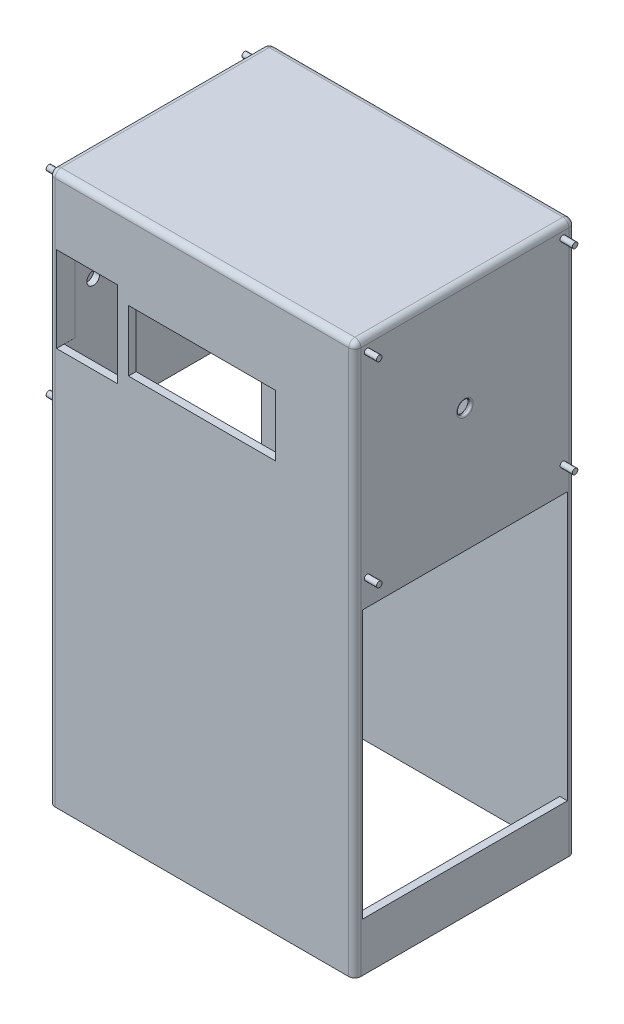
from build123d import *

# Parameters (mm, degrees)
SKETCH1_W           = 127
SKETCH1_H           = 91.44
BOSS_EXTRUDE1_DEPTH = 228.6
SKETCH3_W           = 120.65
SKETCH3_H           = 85.09
CUT_EXTRUDE1_DEPTH  = 226.06
SKETCH2_R           = 2.667
CUT_EXTRUDE2_DEPTH  = 266.475570251
SKETCH4_R           = 1.143
BOSS_EXTRUDE3_DEPTH = 5.08
SKETCH5_R           = 20.32
CUT_EXTRUDE3_DEPTH  = 1.27
FILLET1_R           = 0.762
FILLET2_R           = 0.762
FILLET3_R           = 0.762
SKETCH6_W           = 60.96
SKETCH6_H           = 25.4
CUT_EXTRUDE4_DEPTH  = 256.582569828
FILLET4_R           = 2.54
SKETCH7_W           = 85.09
SKETCH7_H           = 111.152565629
CUT_EXTRUDE5_DEPTH  = 268.942913323
SKETCH10_R          = 2.667
CUT_EXTRUDE6_DEPTH  = 2.54
CUT_EXTRUDE7_DEPTH  = 7.62
SKETCH13_R          = 2.667
CUT_EXTRUDE8_DEPTH  = 2.54
CUT_EXTRUDE9_DEPTH  = 7.62


with BuildPart() as part:
    # Sketch1 → Boss-Extrude1 (new body)
    with BuildSketch(Plane(origin=(0, 0, 0), x_dir=(1, 0, 0), z_dir=(0, 1, 0))):
        Rectangle(SKETCH1_W, SKETCH1_H)
    extrude(amount=BOSS_EXTRUDE1_DEPTH)

    # Sketch3 → Cut-Extrude1 (cut)
    with BuildSketch(Plane.XZ):
        Rectangle(SKETCH3_W, SKETCH3_H)
    extrude(amount=-CUT_EXTRUDE1_DEPTH, mode=Mode.SUBTRACT)

    # Sketch2 → Cut-Extrude2 (cut, through all)
    with BuildSketch(Plane(origin=(63.5, 0, 0), x_dir=(0, 0, -1), z_dir=(1, 0, 0))):
        with Locations((0, 182.88)):
            Circle(SKETCH2_R)
    extrude(amount=-CUT_EXTRUDE2_DEPTH, mode=Mode.SUBTRACT)

    # Sketch4 → Boss-Extrude3 (add)
    with BuildSketch(Plane(origin=(63.5, 0, 0), x_dir=(0, 0, -1), z_dir=(1, 0, 0))):
        with Locations(Location((-40.64, 223.52, 0), (0, 0, 180))):
            Circle(SKETCH4_R)
        with Locations(Location((40.64, 223.52, 0), (0, 0, 180))):
            Circle(SKETCH4_R)
        with Locations(Location((40.64, 142.24, 0), (0, 0, 180))):
            Circle(SKETCH4_R)
        with Locations(Location((-40.64, 142.24, 0), (0, 0, 180))):
            Circle(SKETCH4_R)
    boss_extrude3 = extrude(amount=BOSS_EXTRUDE3_DEPTH)

    # Sketch5 → Cut-Extrude3 (cut)
    with BuildSketch(Plane.ZY.offset(-60.325)):
        with Locations((0, 182.88)):
            Circle(SKETCH5_R)
    cut_extrude3 = extrude(amount=-CUT_EXTRUDE3_DEPTH, mode=Mode.SUBTRACT)

    # Fillet1
    fillet1_edges = [part.edges().sort_by_distance(p)[0] for p in [
        (61.595, 182.88, 2.667),
    ]]
    fillet(fillet1_edges, radius=FILLET1_R)

    # Fillet2
    fillet2_edges = [part.edges().sort_by_distance(p)[0] for p in [
        (63.5, 182.88, 2.667),
    ]]
    fillet(fillet2_edges, radius=FILLET2_R)

    # Mirror2: Boss-Extrude3, Cut-Extrude3 across plane
    add(boss_extrude3.mirror(Plane(origin=(0, 0, 0), x_dir=(0, 0, 1), z_dir=(1, 0, 0))))
    add(cut_extrude3.mirror(Plane(origin=(0, 0, 0), x_dir=(0, 0, 1), z_dir=(1, 0, 0))), mode=Mode.SUBTRACT)

    # Fillet3
    fillet3_edges = [part.edges().sort_by_distance(p)[0] for p in [
        (-63.5, 182.88, 2.667),
        (-61.595, 182.88, 2.667),
    ]]
    fillet(fillet3_edges, radius=FILLET3_R)

    # Sketch6 → Cut-Extrude4 (cut, through all)
    with BuildSketch(Plane.XY.offset(45.72)):
        with Locations((0, 182.88)):
            Rectangle(SKETCH6_W, SKETCH6_H)
    extrude(amount=-CUT_EXTRUDE4_DEPTH, mode=Mode.SUBTRACT)

    # Fillet4
    fillet4_edges = [part.edges().sort_by_distance(p)[0] for p in [
        (-63.5, 228.6, 0),
        (0, 228.6, 45.72),
        (63.5, 228.6, 0),
        (63.5, 114.3, 45.72),
        (-63.5, 114.3, 45.72),
        (-63.5, 114.3, -45.72),
        (63.5, 114.3, -45.72),
        (0, 228.6, -45.72),
    ]]
    fillet(fillet4_edges, radius=FILLET4_R)

    # Sketch7 → Cut-Extrude5 (cut, through all)
    with BuildSketch(Plane(origin=(63.5, 0, 0), x_dir=(0, 0, -1), z_dir=(1, 0, 0))):
        with Locations((0, 75.896282814)):
            Rectangle(SKETCH7_W, SKETCH7_H)
    extrude(amount=-CUT_EXTRUDE5_DEPTH, mode=Mode.SUBTRACT)

    # Sketch10 → Cut-Extrude6 (cut)
    with BuildSketch(Plane.ZY.offset(-60.325)):
        with Locations((-30.48, 182.88)):
            Circle(SKETCH10_R)
    extrude(amount=-CUT_EXTRUDE6_DEPTH, mode=Mode.SUBTRACT)

    # Sketch12 → Cut-Extrude7 (cut)
    with BuildSketch(Plane(origin=(0, 0, -45.72), x_dir=(-1, 0, 0), z_dir=(0, 0, -1))):
        Polygon((-34.810362372, 182.807903476), (-34.810362372, 200.587903476), (-60.210362372, 200.587903476), (-60.210362372, 182.807903476), (-60.210362372, 165.027903476), (-34.810362372, 165.027903476), align=None)
    extrude(amount=-CUT_EXTRUDE7_DEPTH, mode=Mode.SUBTRACT)

    # Sketch13 → Cut-Extrude8 (cut)
    with BuildSketch(Plane(origin=(-60.325, 0, 0), x_dir=(0, 0, -1), z_dir=(1, 0, 0))):
        with Locations((-30.48, 182.88)):
            Circle(SKETCH13_R)
    extrude(amount=-CUT_EXTRUDE8_DEPTH, mode=Mode.SUBTRACT)

    # Sketch16 → Cut-Extrude9 (cut)
    with BuildSketch(Plane.XY.offset(45.72)):
        Polygon((-60.34639287, 182.934228321), (-60.34639287, 200.714228321), (-34.94639287, 200.714228321), (-34.94639287, 165.154228321), (-60.34639287, 165.154228321), align=None)
    extrude(amount=-CUT_EXTRUDE9_DEPTH, mode=Mode.SUBTRACT)


solid = part.part
